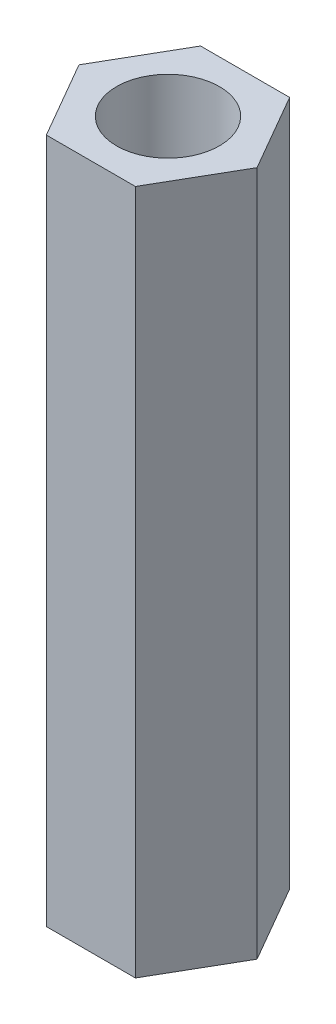
from build123d import *

# Parameters (mm, degrees)
SKETCH1_R           = 1.5
BOSS_EXTRUDE1_DEPTH = 20


with BuildPart() as part:
    # Sketch1 → Boss-Extrude1 (new body)
    with BuildSketch(Plane(origin=(0, 0, 0), x_dir=(1, 0, 0), z_dir=(0, 1, 0))):
        Polygon((2.598076211, 0), (1.299038106, 2.25), (-1.299038106, 2.25), (-2.598076211, 0), (-1.299038106, -2.25), (1.299038106, -2.25), align=None)
        with Locations(Location((0, 0, 0), (0, 0, 270))):
            Circle(SKETCH1_R, mode=Mode.SUBTRACT)
    extrude(amount=BOSS_EXTRUDE1_DEPTH)


solid = part.part
